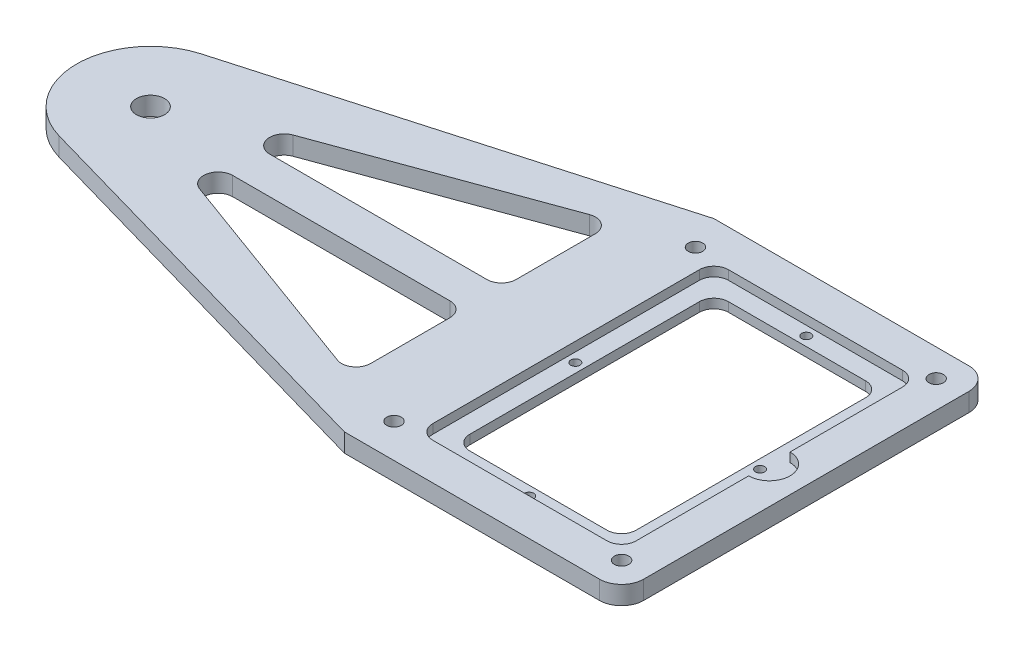
from build123d import *

# Parameters (mm, degrees)
SKETCH1_W           = 95.25
SKETCH1_H           = 127
BOSS_EXTRUDE1_DEPTH = 6.35
BOSS_EXTRUDE3_DEPTH = 6.35
SKETCH5_R           = 4.826
CUT_EXTRUDE1_DEPTH  = 213.985474857
CUT_EXTRUDE2_DEPTH  = 213.985474857
FILLET9_R           = 5
SKETCH7_R           = 5.453804141
BOSS_EXTRUDE4_DEPTH = 6.35
SKETCH8_W           = 69.85
SKETCH8_H           = 101.6
CUT_EXTRUDE3_DEPTH  = 3.175
SKETCH9_W           = 57.15
SKETCH9_H           = 88.9
CUT_EXTRUDE4_DEPTH  = 213.914467862
SKETCH11_R          = 1.5875
CUT_EXTRUDE6_DEPTH  = 213.914467862
CUT_EXTRUDE7_DEPTH  = 3.175
FILLET10_R          = 5
FILLET11_R          = 5
FILLET12_R          = 7.62
SKETCH13_R          = 2.4892
CUT_EXTRUDE8_DEPTH  = 213.985474857


with BuildPart() as part:
    # Sketch1 → Boss-Extrude1 (new body)
    with BuildSketch(Plane(origin=(0, 0, 0), x_dir=(1, 0, 0), z_dir=(0, 1, 0))):
        Rectangle(SKETCH1_W, SKETCH1_H)
    extrude(amount=BOSS_EXTRUDE1_DEPTH)

    # Sketch4 → Boss-Extrude3 (add)
    with BuildSketch(Plane(origin=(0, 6.35, 0), x_dir=(1, 0, 0), z_dir=(0, 1, 0))):
        with BuildLine():
            Line((-47.625, 63.5), (-184.759922998, 24.427842145))
            ThreePointArc((-184.759922998, 24.427842145), (-203.2, 0), (-184.759922998, -24.427842145))
            Line((-184.759922998, -24.427842145), (-47.625, -63.5))
            Line((-47.625, -63.5), (-47.625, 63.5))
        make_face()
    extrude(amount=-BOSS_EXTRUDE3_DEPTH)

    # Sketch5 → Cut-Extrude1 (cut, through all)
    with BuildSketch(Plane(origin=(0, 6.35, 0), x_dir=(1, 0, 0), z_dir=(0, 1, 0))):
        with Locations(Location((-177.8, 0, 0), (0, 0, 270))):
            Circle(SKETCH5_R)
        with Locations(Location((-22.225, 0, 0), (0, 0, 270))):
            Circle(SKETCH5_R)
    extrude(amount=-CUT_EXTRUDE1_DEPTH, mode=Mode.SUBTRACT)

    # Sketch6 → Cut-Extrude2 (cut, through all)
    with BuildSketch(Plane(origin=(0, 6.35, 0), x_dir=(1, 0, 0), z_dir=(0, 1, 0))):
        Polygon((-63.5, 45.771509083), (-171.45, 6.35), (-63.5, 6.35), align=None)
        Polygon((-63.5, -6.35), (-63.5, -45.771509083), (-171.45, -6.35), align=None)
    extrude(amount=-CUT_EXTRUDE2_DEPTH, mode=Mode.SUBTRACT)

    # Fillet9
    fillet9_edges = [part.edges().sort_by_distance(p)[0] for p in [
        (-63.5, 3.175, -45.771509083),
        (-63.5, 3.175, -6.35),
        (-171.45, 3.175, -6.35),
        (-171.45, 3.175, 6.35),
        (-63.5, 3.175, 6.35),
        (-63.5, 3.175, 45.771509083),
    ]]
    fillet(fillet9_edges, radius=FILLET9_R)

    # Sketch7 → Boss-Extrude4 (add)
    with BuildSketch(Plane(origin=(0, 6.35, 0), x_dir=(1, 0, 0), z_dir=(0, 1, 0))):
        with Locations((-22.225, 0)):
            Circle(SKETCH7_R)
    extrude(amount=-BOSS_EXTRUDE4_DEPTH)

    # Sketch8 → Cut-Extrude3 (cut)
    with BuildSketch(Plane(origin=(0, 6.35, 0), x_dir=(1, 0, 0), z_dir=(0, 1, 0))):
        Rectangle(SKETCH8_W, SKETCH8_H)
    extrude(amount=-CUT_EXTRUDE3_DEPTH, mode=Mode.SUBTRACT)

    # Sketch9 → Cut-Extrude4 (cut, through all)
    with BuildSketch(Plane(origin=(0, 3.175, 0), x_dir=(1, 0, 0), z_dir=(0, 1, 0))):
        Rectangle(SKETCH9_W, SKETCH9_H)
    extrude(amount=-CUT_EXTRUDE4_DEPTH, mode=Mode.SUBTRACT)

    # Sketch11 → Cut-Extrude6 (cut, through all)
    with BuildSketch(Plane(origin=(0, 3.175, 0), x_dir=(1, 0, 0), z_dir=(0, 1, 0))):
        with Locations(Location((-31.75, 0, 0), (0, 0, 270))):
            Circle(SKETCH11_R)
        with Locations(Location((31.75, 0, 0), (0, 0, 90))):
            Circle(SKETCH11_R)
        with Locations(Location((0, 47.625, 0), (0, 0, 270))):
            Circle(SKETCH11_R)
        with Locations(Location((0, -47.625, 0), (0, 0, 90))):
            Circle(SKETCH11_R)
    extrude(amount=-CUT_EXTRUDE6_DEPTH, mode=Mode.SUBTRACT)

    # Sketch12 → Cut-Extrude7 (cut)
    with BuildSketch(Plane(origin=(0, 6.35, 0), x_dir=(1, 0, 0), z_dir=(0, 1, 0))):
        with BuildLine():
            Line((34.925, 7.112), (34.925, -7.112))
            ThreePointArc((34.925, -7.112), (42.037, 0), (34.925, 7.112))
        make_face()
    extrude(amount=-CUT_EXTRUDE7_DEPTH, mode=Mode.SUBTRACT)

    # Fillet10
    fillet10_edges = [part.edges().sort_by_distance(p)[0] for p in [
        (-34.925, 4.7625, -50.8),
        (34.925, 4.7625, -50.8),
        (34.925, 4.7625, 50.8),
        (-34.925, 4.7625, 50.8),
    ]]
    fillet(fillet10_edges, radius=FILLET10_R)

    # Fillet11
    fillet11_edges = [part.edges().sort_by_distance(p)[0] for p in [
        (-28.575, 1.5875, 44.45),
        (-28.575, 1.5875, -44.45),
        (28.575, 1.5875, -44.45),
        (28.575, 1.5875, 44.45),
    ]]
    fillet(fillet11_edges, radius=FILLET11_R)

    # Fillet12
    fillet12_edges = [part.edges().sort_by_distance(p)[0] for p in [
        (47.625, 3.175, 63.5),
        (47.625, 3.175, -63.5),
    ]]
    fillet(fillet12_edges, radius=FILLET12_R)

    # Sketch13 → Cut-Extrude8 (cut, through all)
    with BuildSketch(Plane(origin=(0, 6.35, 0), x_dir=(1, 0, 0), z_dir=(0, 1, 0))):
        with Locations(Location((-42.286053483, 51.811053483, 0), (0, 0, 270))):
            Circle(SKETCH13_R)
        with Locations(Location((-42.286053483, -51.811053483, 0), (0, 0, 270))):
            Circle(SKETCH13_R)
        with Locations(Location((38.202339924, -54.077339924, 0), (0, 0, 270))):
            Circle(SKETCH13_R)
        with Locations(Location((38.202339924, 54.077339924, 0), (0, 0, 270))):
            Circle(SKETCH13_R)
    extrude(amount=-CUT_EXTRUDE8_DEPTH, mode=Mode.SUBTRACT)


solid = part.part
